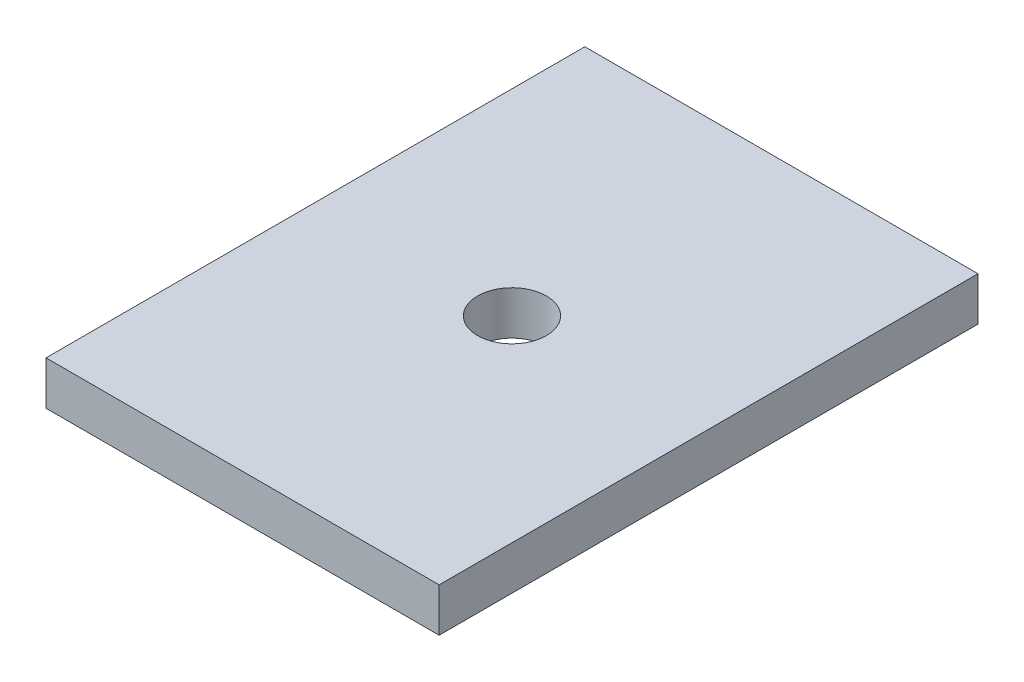
from build123d import *

# Parameters (mm, degrees)
SKETCH2_W           = 171.45
SKETCH2_H           = 235
SKETCH2_R           = 15
BOSS_EXTRUDE3_DEPTH = 19.05


with BuildPart() as part:
    # Sketch2 → Boss-Extrude3 (new body)
    with BuildSketch(Plane(origin=(0, 0, 0), x_dir=(1, 0, 0), z_dir=(0, 1, 0))):
        Rectangle(SKETCH2_W, SKETCH2_H)
        with Locations(Location((0, 0, 0), (0, 0, 90))):
            Circle(SKETCH2_R, mode=Mode.SUBTRACT)
    extrude(amount=BOSS_EXTRUDE3_DEPTH)


solid = part.part
